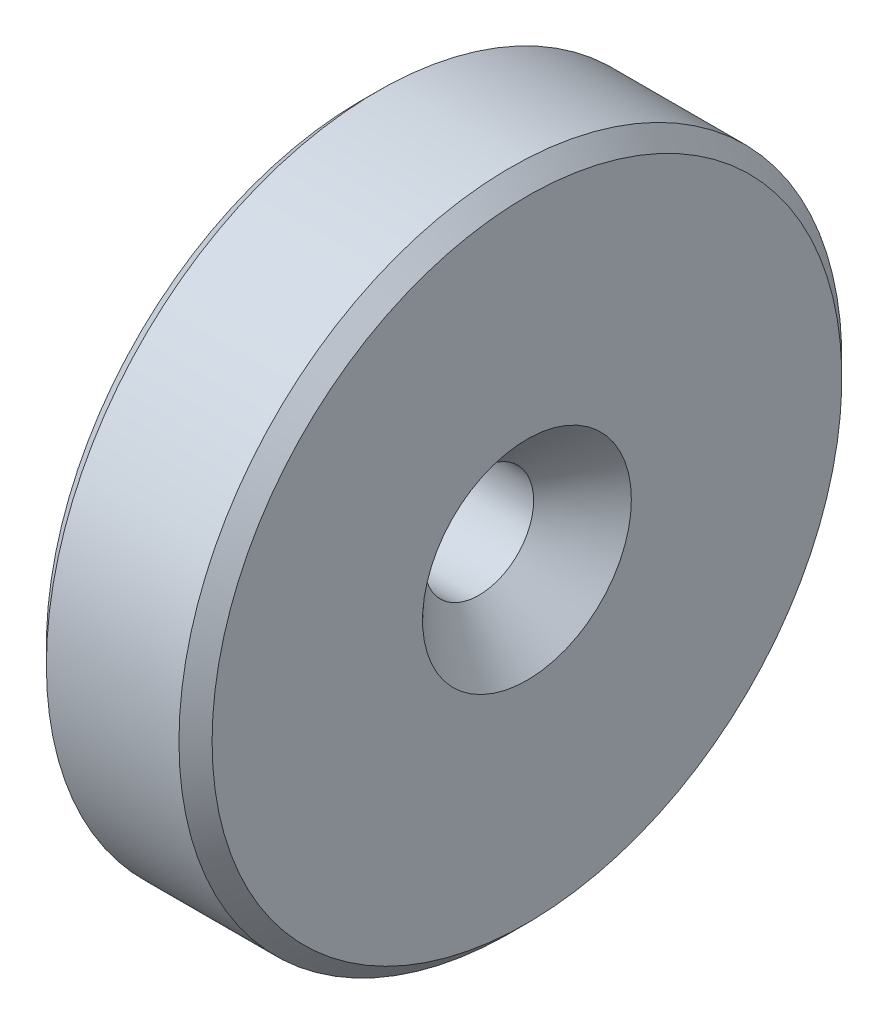
from build123d import *

# Parameters (mm, degrees)
ESQUISSE1_W             = 10
ESQUISSE1_H             = 20
CHANFREIN1_SIZE         = 1
PER_AGE1_D              = 6.6
PER_AGE1_CSINK_D        = 12.6
PER_AGE1_CSINK_ANGLE    = 92
ESQUISSE5_W             = 2.1
ESQUISSE5_H             = 0.25
ENL_V_MAT_EXTRU_1_DEPTH = 20


with BuildPart() as part:
    # Esquisse1 → Base-Révolution (revolve)
    with BuildSketch(Plane.XY, mode=Mode.PRIVATE) as base_r_volution_sk:
        with Locations((5, 10)):
            Rectangle(ESQUISSE1_W, ESQUISSE1_H)
    revolve(base_r_volution_sk.sketch.rotate(Axis((0, 0, 0), (1, 0, 0)), 90), axis=Axis((0, 0, 0), (1, 0, 0)))

    # Chanfrein1
    chanfrein1_edges = [part.edges().sort_by_distance(p)[0] for p in [
        (10, 0, -20),
        (0, 0, -20),
    ]]
    chamfer(chanfrein1_edges, length=CHANFREIN1_SIZE)

    # Perçage1 (through all)
    with Locations(Plane(origin=(10, 0, 0), x_dir=(0, 0, -1), z_dir=(1, 0, 0))):
        with Locations((0, 0)):
            CounterSinkHole(PER_AGE1_D / 2, PER_AGE1_CSINK_D / 2, counter_sink_angle=PER_AGE1_CSINK_ANGLE)

    # Esquisse5 → Enlèv. mat.-Extru.1 (cut, symmetric)
    with BuildSketch(Plane(origin=(0, 0, 0), x_dir=(1, 0, 0), z_dir=(0, 1, 0))):
        with Locations((-0.95, 0)):
            Rectangle(ESQUISSE5_W, ESQUISSE5_H)
    extrude(amount=ENL_V_MAT_EXTRU_1_DEPTH, both=True, mode=Mode.SUBTRACT)


solid = part.part
